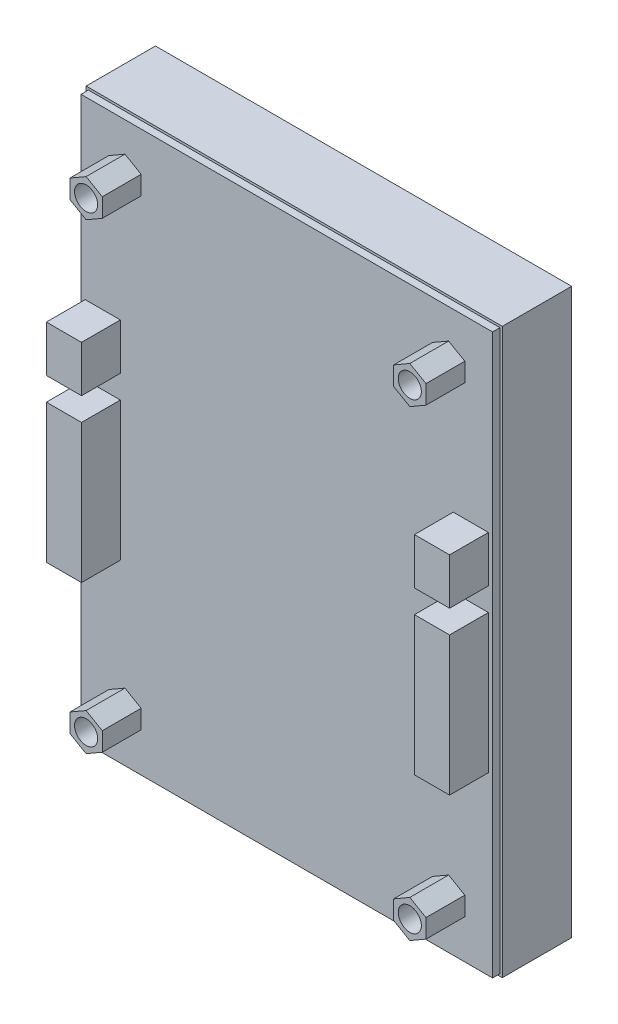
from build123d import *

# Parameters (mm, degrees)
MODEL_W             = 90
MODEL_H             = 122
BOSS_EXTRUDE1_DEPTH = 15
MODEL_3_W           = 89
MODEL_3_H           = 121
BOSS_EXTRUDE2_DEPTH = 1.6
BOSS_EXTRUDE3_DEPTH = 10
MODEL_5_W           = 7.6
MODEL_5_H           = 10
BOSS_EXTRUDE4_DEPTH = 10
MODEL_6_W           = 7.6
MODEL_6_H           = 30
BOSS_EXTRUDE5_DEPTH = 10
MODEL_7_R           = 2.5
CUT_EXTRUDE1_DEPTH  = 10
SKETCH4_R           = 4.955800122
CUT_EXTRUDE2_DEPTH  = 2


with BuildPart() as part:
    # Model → Boss-Extrude1 (new body)
    with BuildSketch(Plane.XY):
        Rectangle(MODEL_W, MODEL_H)
    extrude(amount=-BOSS_EXTRUDE1_DEPTH)

    # Model<3> → Boss-Extrude2 (add)
    with BuildSketch(Plane.XY):
        Rectangle(MODEL_3_W, MODEL_3_H)
    extrude(amount=BOSS_EXTRUDE2_DEPTH)

    # Model<4> → Boss-Extrude3 (add)
    with BuildSketch(Plane.XY):
        Polygon((-35, 45.958548116), (-31.5, 47.979274058), (-31.5, 52.020725942), (-35, 54.041451884), (-38.5, 52.020725942), (-38.5, 47.979274058), align=None)
        Polygon((35, 45.958548116), (38.5, 47.979274058), (38.5, 52.020725942), (35, 54.041451884), (31.5, 52.020725942), (31.5, 47.979274058), align=None)
        Polygon((35, -45.958548116), (31.5, -47.979274058), (31.5, -52.020725942), (35, -54.041451884), (38.5, -52.020725942), (38.5, -47.979274058), align=None)
        Polygon((-35, -45.958548116), (-38.5, -47.979274058), (-38.5, -52.020725942), (-35, -54.041451884), (-31.5, -52.020725942), (-31.5, -47.979274058), align=None)
    extrude(amount=BOSS_EXTRUDE3_DEPTH)

    # Model<5> → Boss-Extrude4 (add)
    with BuildSketch(Plane.XY):
        with Locations((-39.8, 17.5)):
            Rectangle(MODEL_5_W, MODEL_5_H)
        with Locations((39.8, 17.5)):
            Rectangle(MODEL_5_W, MODEL_5_H)
    extrude(amount=BOSS_EXTRUDE4_DEPTH)

    # Model<6> → Boss-Extrude5 (add)
    with BuildSketch(Plane.XY):
        with Locations((-39.8, -7.5)):
            Rectangle(MODEL_6_W, MODEL_6_H)
        with Locations((39.8, -7.5)):
            Rectangle(MODEL_6_W, MODEL_6_H)
    extrude(amount=BOSS_EXTRUDE5_DEPTH)

    # Model<7> → Cut-Extrude1 (cut)
    with BuildSketch(Plane.XY):
        with Locations((-35, 50)):
            Circle(MODEL_7_R)
        with Locations((35, 50)):
            Circle(MODEL_7_R)
        with Locations((-35, -50)):
            Circle(MODEL_7_R)
        with Locations((35, -50)):
            Circle(MODEL_7_R)
    extrude(amount=CUT_EXTRUDE1_DEPTH, mode=Mode.SUBTRACT)

    # Sketch4 → Cut-Extrude2 (cut)
    with BuildSketch(Plane(origin=(0, 0, -15), x_dir=(-1, 0, 0), z_dir=(0, 0, -1))):
        Polygon((19.1392, -4.0613), (25.369, 0.0335), (19.9902, 4.7816), (0, 4.796944772), (-17.1378, 4.8101), (-23.6203, 0.0312), (-19.0147, -4.0613), align=None)
        Polygon((-10.7582, 40.4232), (26.2696, 40.4232), (33.6508, 47.2956), (31.0232, 48.9196), (28.271, 50.0448), (-11.259, 50.0448), (-13.5104, 49.9194), (-15.8871, 49.1702), align=None)
        Polygon((-38.029, -40.7988), (-37.1536, -42.7978), (-36.13, -44.9525), (-29.1472, -39.6744), (-22.2668, -5.0611), (-26.7704, -1.1876), (-30.8986, -4.3118), align=None)
        Polygon((-25.7696, 1.5615), (-19.7654, 5.9353), (-12.654031371, 40.081219045), (-17.3886, 48.2956), (-18.8893, 46.9206), (-20.0154, 45.2958), (-20.8906, 43.5466), (-21.3914, 41.5476), (-29.0226, 3.56045), align=None)
        Polygon((29.1472, 40.4232), (22.3922, 6.4348), (27.3956, 2.061), (31.5238, 4.8101), (38.013524934, 40.463880597), (37.2782, 42.4222), (36.152, 44.1714), (34.9014, 45.9206), align=None)
        Polygon((27.771, -1.937), (20.14, -6.9356), (13.3477, -39.4168), (18.3604, -47.3956), (21.016, -44.298), (29.647, -3.5617), align=None)
        Polygon((-30.2732, -49.5456), (12.7596, -49.5456), (16.652, -48.4566), (11.8843, -40.7988), (-26.2704, -40.8369), (-34.276, -47.0464), align=None)
        with Locations((31.0232, -47.0464)):
            Circle(SKETCH4_R)
    extrude(amount=-CUT_EXTRUDE2_DEPTH, mode=Mode.SUBTRACT)


solid = part.part
